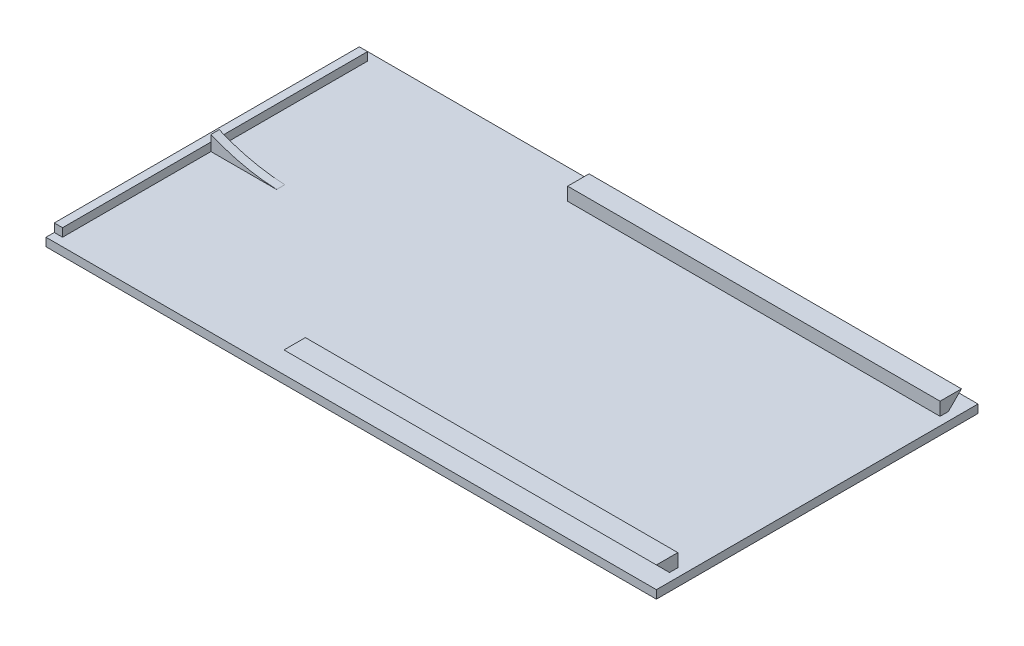
from build123d import *

# Parameters (mm, degrees)
ESBO_O1_W                = 93
ESBO_O1_H                = 49
RESSALTO_EXTRUS_O1_DEPTH = 1.26
ESBO_O2_W                = 1.26
ESBO_O2_H                = 46.48
RESSALTO_EXTRUS_O2_DEPTH = 1.26
ESBO_O3_W                = 10
ESBO_O3_H                = 1.26
RESSALTO_EXTRUS_O3_DEPTH = 2.26
CORTE_EXTRUS_O1_DEPTH    = 1.26
ESBO_O5_W                = 56.74
ESBO_O5_H                = 3.26
RESSALTO_EXTRUS_O4_DEPTH = 2
CORTE_EXTRUS_O3_DEPTH    = 62


with BuildPart() as part:
    # Esboço1 → Ressalto-extrusão1 (new body)
    with BuildSketch(Plane(origin=(0, 0, 0), x_dir=(1, 0, 0), z_dir=(0, 1, 0))):
        with Locations((46.5, 24.5)):
            Rectangle(ESBO_O1_W, ESBO_O1_H)
    extrude(amount=RESSALTO_EXTRUS_O1_DEPTH)

    # Esboço2 → Ressalto-extrusão2 (add)
    with BuildSketch(Plane(origin=(0, 1.26, 0), x_dir=(1, 0, 0), z_dir=(0, 1, 0))):
        with Locations((0.63, 24.5)):
            Rectangle(ESBO_O2_W, ESBO_O2_H)
    extrude(amount=RESSALTO_EXTRUS_O2_DEPTH)

    # Esboço3 → Ressalto-extrusão3 (add)
    with BuildSketch(Plane(origin=(0, 1.26, 0), x_dir=(1, 0, 0), z_dir=(0, 1, 0))):
        with Locations((6.26, 24.5)):
            Rectangle(ESBO_O3_W, ESBO_O3_H)
    extrude(amount=RESSALTO_EXTRUS_O3_DEPTH)

    # Esboço4 → Corte-extrusão1 (cut)
    with BuildSketch(Plane.XY.offset(-23.87)):
        with BuildLine():
            Line((1.26, 3.52), (11.26, 3.52))
            Line((11.26, 3.52), (11.26, 1.26))
            ThreePointArc((11.26, 1.26), (6.158122993, 1.939216781), (1.26, 3.52))
        make_face()
    extrude(amount=-CORTE_EXTRUS_O1_DEPTH, mode=Mode.SUBTRACT)

    # Esboço5 → Ressalto-extrusão4 (add)
    with BuildSketch(Plane(origin=(0, 1.26, 0), x_dir=(1, 0, 0), z_dir=(0, 1, 0))):
        with Locations((63.37, 2.89)):
            Rectangle(ESBO_O5_W, ESBO_O5_H)
        with Locations((63.37, 46.11)):
            Rectangle(ESBO_O5_W, ESBO_O5_H)
    extrude(amount=RESSALTO_EXTRUS_O4_DEPTH)

    # Esboço6 → Corte-extrusão3 (cut)
    with BuildSketch(Plane(origin=(91.74, 0, 0), x_dir=(0, 0, -1), z_dir=(1, 0, 0))):
        Polygon((3.262223764, 1.26), (1.26, 3.26), (1.26, 1.26), align=None)
        Polygon((45.737776236, 1.26), (47.74, 3.26), (47.74, 1.26), align=None)
    extrude(amount=-CORTE_EXTRUS_O3_DEPTH, mode=Mode.SUBTRACT)


solid = part.part
